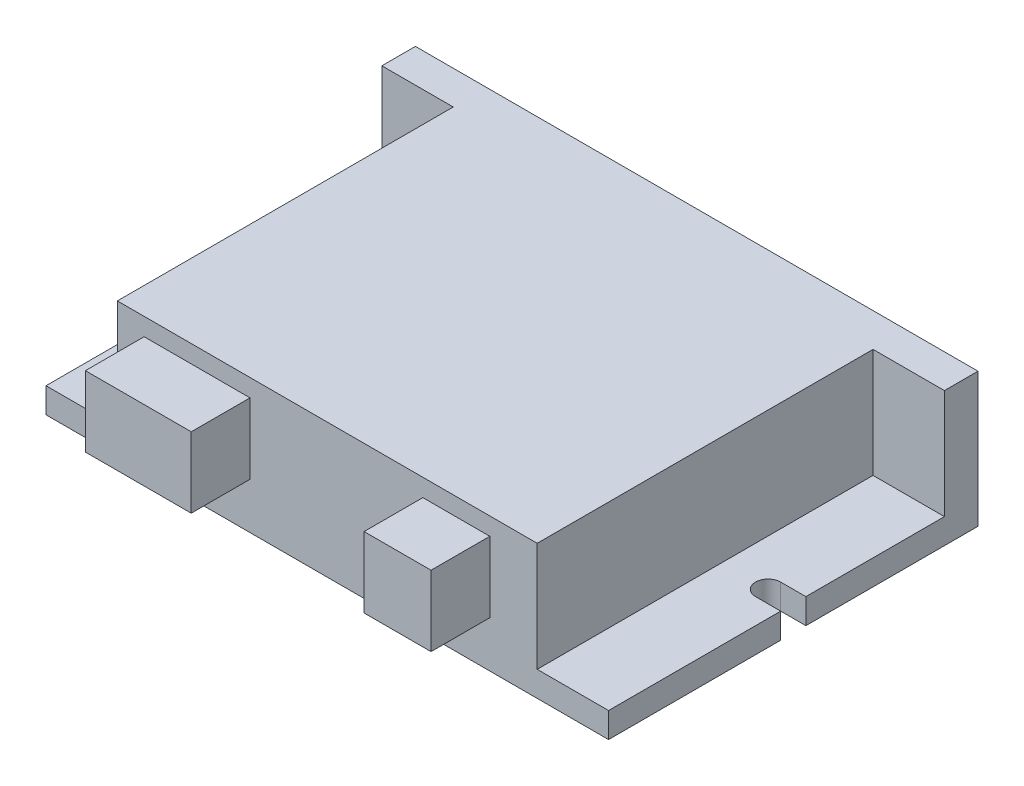
from build123d import *

# Parameters (mm, degrees)
SKETCH2_W               = 85.09
SKETCH2_H               = 55.88
BOSS_EXTRUDE1_DEPTH     = 3.81
SKETCH3_W               = 63.5
SKETCH3_H               = 50.8
BOSS_EXTRUDE2_DEPTH     = 16.51
SKETCH4_W               = 85.09
SKETCH4_H               = 5.08
BOSS_EXTRUDE3_DEPTH     = 16.51
CUT_EXTRUDE1_DEPTH      = 54.509818959
CUT_EXTRUDE1_DEPTH_BACK = 54.509818959
SKETCH6_W               = 16.01364416
SKETCH6_H               = 10.668
SKETCH6_W_2             = 10.127547929
BOSS_EXTRUDE4_DEPTH     = 8.89


with BuildPart() as part:
    # Sketch2 → Boss-Extrude1 (new body)
    with BuildSketch(Plane(origin=(0, 0, 0), x_dir=(1, 0, 0), z_dir=(0, 1, 0))):
        Rectangle(SKETCH2_W, SKETCH2_H)
    extrude(amount=BOSS_EXTRUDE1_DEPTH)

    # Sketch3 → Boss-Extrude2 (add)
    with BuildSketch(Plane(origin=(0, 3.81, 0), x_dir=(1, 0, 0), z_dir=(0, 1, 0))):
        with Locations((0, -2.54)):
            Rectangle(SKETCH3_W, SKETCH3_H)
    extrude(amount=BOSS_EXTRUDE2_DEPTH)

    # Sketch4 → Boss-Extrude3 (add)
    with BuildSketch(Plane(origin=(0, 3.81, 0), x_dir=(1, 0, 0), z_dir=(0, 1, 0))):
        with Locations((0, 25.4)):
            Rectangle(SKETCH4_W, SKETCH4_H)
    extrude(amount=BOSS_EXTRUDE3_DEPTH)

    # Sketch5 → Cut-Extrude1 (cut, two sides: drawn at the far end of the back side and taken through both)
    with BuildSketch(Plane(origin=(0, 3.81, 0), x_dir=(1, 0, 0), z_dir=(0, 1, 0)).offset(-CUT_EXTRUDE1_DEPTH_BACK)):
        with BuildLine():
            Line((38.735, 1.905), (42.545, 1.905))
            Line((42.545, 1.905), (42.545, -1.905))
            Line((42.545, -1.905), (38.735, -1.905))
            ThreePointArc((38.735, -1.905), (36.83, 0), (38.735, 1.905))
        make_face()
        with BuildLine():
            Line((-42.545, 1.905), (-42.545, -1.905))
            Line((-42.545, -1.905), (-38.735, -1.905))
            ThreePointArc((-38.735, -1.905), (-36.83, 0), (-38.735, 1.905))
            Line((-38.735, 1.905), (-42.545, 1.905))
        make_face()
    extrude(amount=CUT_EXTRUDE1_DEPTH + CUT_EXTRUDE1_DEPTH_BACK, mode=Mode.SUBTRACT)

    # Sketch6 → Boss-Extrude4 (add)
    with BuildSketch(Plane.XY.offset(27.94)):
        with Locations((-19.692454306, 12.319)):
            Rectangle(SKETCH6_W, SKETCH6_H)
        with Locations((19.519333829, 12.319)):
            Rectangle(SKETCH6_W_2, SKETCH6_H)
    extrude(amount=BOSS_EXTRUDE4_DEPTH)


solid = part.part
